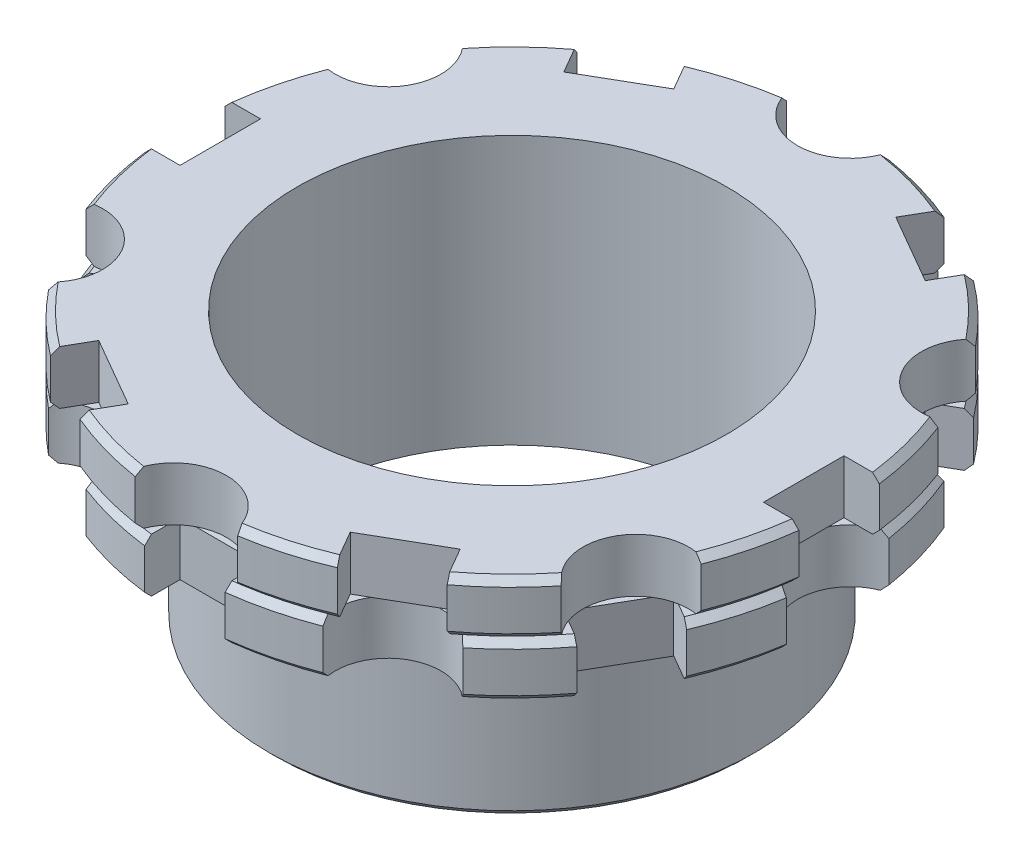
from build123d import *

# Parameters (mm, degrees)
SKETCH2_R          = 3.94
SKETCH2_W          = 7
SKETCH2_H          = 6
CUT_EXTRUDE1_DEPTH = 4
SKETCH3_R          = 3.94
SKETCH3_W          = 6
SKETCH3_H          = 7
CUT_EXTRUDE2_DEPTH = 4


with BuildPart() as part:
    # Sketch1 → Revolve1 (revolve)
    with BuildSketch(Plane(origin=(0, 0, 0), x_dir=(0, 0, -1), z_dir=(1, 0, 0)), mode=Mode.PRIVATE) as revolve1_sk:
        with BuildLine():
            Line((16, -67), (17.6, -67))
            Line((17.6, -67), (18.1, -66.5))
            Line((18.1, -66.5), (18.1, -55.4))
            ThreePointArc((18.1, -55.4), (18.217157288, -55.117157288), (18.5, -55))
            Line((18.5, -55), (24.07, -55))
            Line((24.07, -55), (24.57, -54.5))
            Line((24.57, -54.5), (24.57, -51.5))
            Line((24.57, -51.5), (24.07, -51))
            Line((24.07, -51), (24.57, -50.5))
            Line((24.57, -50.5), (24.57, -47.5))
            Line((24.57, -47.5), (24.07, -47))
            Line((24.07, -47), (16, -47))
            Line((16, -47), (16, -67))
        make_face()
    revolve(revolve1_sk.sketch.rotate(Axis((0, 0, 0), (0, -1, 0)), 180), axis=Axis((0, 0, 0), (0, -1, 0)))

    # Sketch2 → Cut-Extrude1 (cut)
    with BuildSketch(Plane(origin=(0, -47, 0), x_dir=(1, 0, 0), z_dir=(0, 1, 0))):
        with Locations((0, 25.23)):
            Circle(SKETCH2_R)
        with Locations((21.849820937, 12.615)):
            Circle(SKETCH2_R)
        with Locations((21.849820937, -12.615)):
            Circle(SKETCH2_R)
        with Locations((0, -25.23)):
            Circle(SKETCH2_R)
        with Locations((-21.849820937, -12.615)):
            Circle(SKETCH2_R)
        with Locations((-21.849820937, 12.615)):
            Circle(SKETCH2_R)
        Polygon((11.776923789, 26.398230359), (8.276923789, 20.336052532), (13.473076211, 17.336052532), (16.973076211, 23.398230359), align=None)
        with Locations((25.25, 0)):
            Rectangle(SKETCH2_W, SKETCH2_H)
        Polygon((16.973076211, -23.398230359), (13.473076211, -17.336052532), (8.276923789, -20.336052532), (11.776923789, -26.398230359), align=None)
        Polygon((-11.776923789, -26.398230359), (-8.276923789, -20.336052532), (-13.473076211, -17.336052532), (-16.973076211, -23.398230359), align=None)
        with Locations((-25.25, 0)):
            Rectangle(SKETCH2_W, SKETCH2_H)
        Polygon((-16.973076211, 23.398230359), (-13.473076211, 17.336052532), (-8.276923789, 20.336052532), (-11.776923789, 26.398230359), align=None)
    extrude(amount=-CUT_EXTRUDE1_DEPTH, mode=Mode.SUBTRACT)

    # Sketch3 → Cut-Extrude2 (cut)
    with BuildSketch(Plane(origin=(0, -51, 0), x_dir=(1, 0, 0), z_dir=(0, 1, 0))):
        with Locations((12.615, 21.849820937)):
            Circle(SKETCH3_R)
        with Locations((25.23, 0)):
            Circle(SKETCH3_R)
        with Locations((12.615, -21.849820937)):
            Circle(SKETCH3_R)
        with Locations((-12.615, -21.849820937)):
            Circle(SKETCH3_R)
        with Locations((-25.23, 0)):
            Circle(SKETCH3_R)
        with Locations((-12.615, 21.849820937)):
            Circle(SKETCH3_R)
        with Locations((0, 25.25)):
            Rectangle(SKETCH3_W, SKETCH3_H)
        Polygon((23.398230359, 16.973076211), (17.336052532, 13.473076211), (20.336052532, 8.276923789), (26.398230359, 11.776923789), align=None)
        Polygon((26.398230359, -11.776923789), (20.336052532, -8.276923789), (17.336052532, -13.473076211), (23.398230359, -16.973076211), align=None)
        with Locations((0, -25.25)):
            Rectangle(SKETCH3_W, SKETCH3_H)
        Polygon((-23.398230359, -16.973076211), (-17.336052532, -13.473076211), (-20.336052532, -8.276923789), (-26.398230359, -11.776923789), align=None)
        Polygon((-26.398230359, 11.776923789), (-20.336052532, 8.276923789), (-17.336052532, 13.473076211), (-23.398230359, 16.973076211), align=None)
    extrude(amount=-CUT_EXTRUDE2_DEPTH, mode=Mode.SUBTRACT)


solid = part.part
